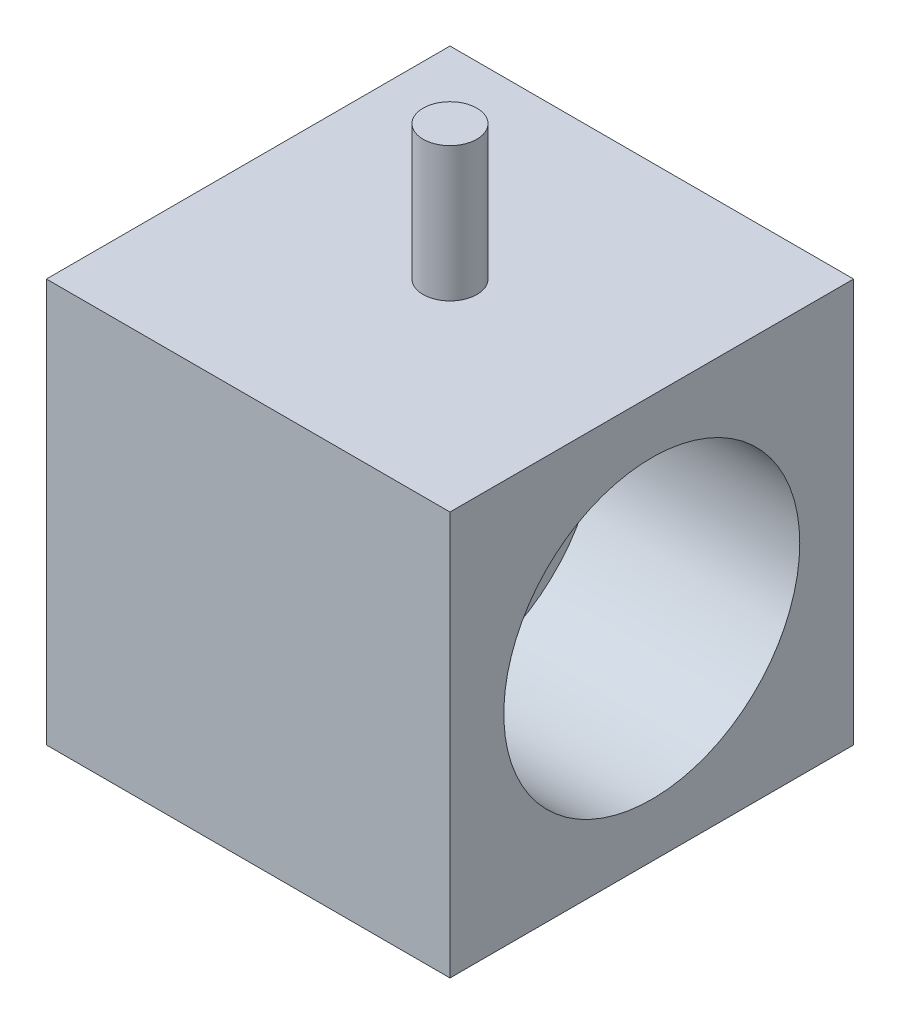
from build123d import *

# Parameters (mm, degrees)
SKETCH1_W           = 30
SKETCH1_H           = 30
BOSS_EXTRUDE1_DEPTH = 30
SKETCH2_R           = 11
CUT_EXTRUDE1_DEPTH  = 15
SKETCH3_R           = 2
BOSS_EXTRUDE2_DEPTH = 10


with BuildPart() as part:
    # Sketch1 → Boss-Extrude1 (new body)
    with BuildSketch(Plane(origin=(0, 0, 0), x_dir=(1, 0, 0), z_dir=(0, 1, 0))):
        Rectangle(SKETCH1_W, SKETCH1_H)
    extrude(amount=BOSS_EXTRUDE1_DEPTH)

    # Sketch2 → Cut-Extrude1 (cut)
    with BuildSketch(Plane(origin=(15, 0, 0), x_dir=(0, 0, -1), z_dir=(1, 0, 0))):
        with Locations((0, 15)):
            Circle(SKETCH2_R)
    extrude(amount=-CUT_EXTRUDE1_DEPTH, mode=Mode.SUBTRACT)

    # Sketch3 → Boss-Extrude2 (add)
    with BuildSketch(Plane(origin=(0, 30, 0), x_dir=(1, 0, 0), z_dir=(0, 1, 0))):
        with Locations(Location((0, 0, 0), (0, 0, 270))):
            Circle(SKETCH3_R)
    extrude(amount=BOSS_EXTRUDE2_DEPTH)


solid = part.part
